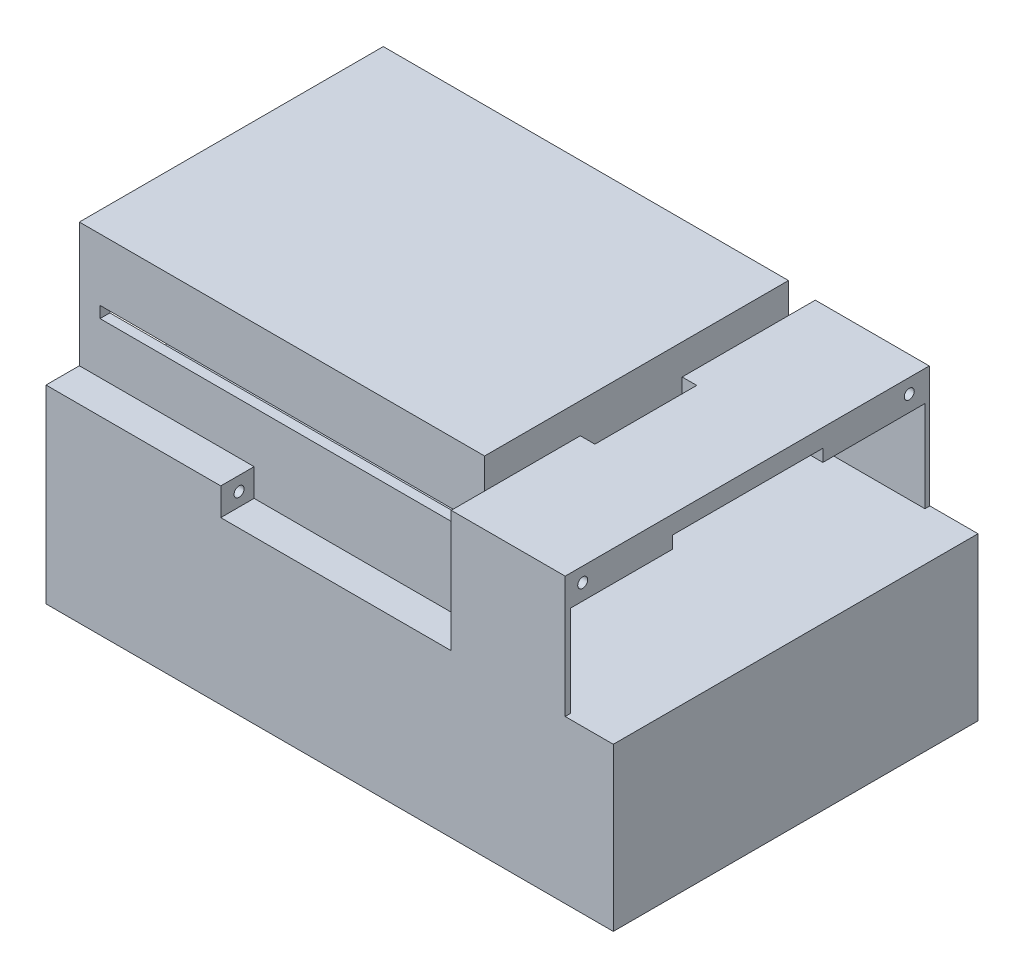
from build123d import *

# Parameters (mm, degrees)
SKETCH1_W           = 142.24
SKETCH1_H           = 91.44
BOSS_EXTRUDE1_DEPTH = 40.64
SKETCH3_W           = 101.6
SKETCH3_H           = 76.2
BOSS_EXTRUDE2_DEPTH = 38.1
SKETCH4_W           = 70.885711102
SKETCH4_H           = 34.639527003
CUT_EXTRUDE2_DEPTH  = 97.79
SKETCH5_W           = 90.875163882
SKETCH5_H           = 2.870686322
CUT_EXTRUDE3_DEPTH  = 97.79
SKETCH8_W           = 91.28479526
SKETCH8_H           = 30.48
BOSS_EXTRUDE4_DEPTH = 28.575
SKETCH9_W           = 37.704579212
SKETCH9_H           = 3.084273822
CUT_EXTRUDE4_DEPTH  = 28.321
SKETCH10_W          = 3.65161605
SKETCH10_H          = 25.540665071
CUT_EXTRUDE5_DEPTH  = 14.097
SKETCH2_W           = 87.63
SKETCH2_H           = 36.83
CUT_EXTRUDE6_DEPTH  = 225.933
SKETCH12_W          = 91.44
SKETCH12_H          = 40.64
BOSS_EXTRUDE5_DEPTH = 2.667
SKETCH13_W          = 6.720820965
SKETCH13_H          = 6.891818051
SKETCH13_R          = 1.25
SKETCH13_W_2        = 8.363974295
BOSS_EXTRUDE6_DEPTH = 43.815
SKETCH14_R          = 1.25
CUT_EXTRUDE7_DEPTH  = 13.843


with BuildPart() as part:
    # Sketch1 → Boss-Extrude1 (new body)
    with BuildSketch(Plane(origin=(0, 0, 0), x_dir=(1, 0, 0), z_dir=(0, 1, 0))):
        Rectangle(SKETCH1_W, SKETCH1_H)
    extrude(amount=BOSS_EXTRUDE1_DEPTH)

    # Sketch3 → Boss-Extrude2 (add)
    with BuildSketch(Plane(origin=(0, 40.64, 0), x_dir=(1, 0, 0), z_dir=(0, 1, 0))):
        with Locations((-20.32, 0.743974295)):
            Rectangle(SKETCH3_W, SKETCH3_H)
    extrude(amount=BOSS_EXTRUDE2_DEPTH)

    # Sketch4 → Cut-Extrude2 (cut)
    with BuildSketch(Plane.ZY.offset(71.12)):
        with Locations((-0.546263413, 58.617752018)):
            Rectangle(SKETCH4_W, SKETCH4_H)
    extrude(amount=-CUT_EXTRUDE2_DEPTH, mode=Mode.SUBTRACT)

    # Sketch5 → Cut-Extrude3 (cut)
    with BuildSketch(Plane.XY.offset(37.356025705)):
        with Locations((-20.498494518, 61.797236891)):
            Rectangle(SKETCH5_W, SKETCH5_H)
    extrude(amount=-CUT_EXTRUDE3_DEPTH, mode=Mode.SUBTRACT)

    # Sketch8 → Boss-Extrude4 (add)
    with BuildSketch(Plane(origin=(30.48, 0, 0), x_dir=(0, 0, -1), z_dir=(1, 0, 0))):
        with Locations((-0.07760237, 55.88)):
            Rectangle(SKETCH8_W, SKETCH8_H)
    extrude(amount=BOSS_EXTRUDE4_DEPTH)

    # Sketch9 → Cut-Extrude4 (cut)
    with BuildSketch(Plane(origin=(59.055, 0, 0), x_dir=(0, 0, -1), z_dir=(1, 0, 0))):
        with Locations((0.04199785, 65.042136911)):
            Rectangle(SKETCH9_W, SKETCH9_H)
        with Locations((0.04199785, 61.957863089)):
            Rectangle(SKETCH9_W, SKETCH9_H)
        Polygon((-18.810291756, 63.5), (-44.40800215, 63.5), (-44.40800215, 40.64), (44.49199785, 40.64), (44.49199785, 63.5), (18.894287456, 63.5), (18.894287456, 60.415726178), (-18.810291756, 60.415726178), align=None)
    extrude(amount=-CUT_EXTRUDE4_DEPTH, mode=Mode.SUBTRACT)

    # Sketch10 → Cut-Extrude5 (cut)
    with BuildSketch(Plane(origin=(0, 71.12, 0), x_dir=(1, 0, 0), z_dir=(0, 1, 0))):
        with Locations((32.305808025, -0.58046966)):
            Rectangle(SKETCH10_W, SKETCH10_H)
    extrude(amount=-CUT_EXTRUDE5_DEPTH, mode=Mode.SUBTRACT)

    # Sketch2 → Cut-Extrude6 (cut)
    with BuildSketch(Plane(origin=(71.12, 0, 0), x_dir=(0, 0, -1), z_dir=(1, 0, 0))):
        with Locations((0, 20.32)):
            Rectangle(SKETCH2_W, SKETCH2_H)
    extrude(amount=-CUT_EXTRUDE6_DEPTH, mode=Mode.SUBTRACT)

    # Sketch12 → Boss-Extrude5 (add)
    with BuildSketch(Plane(origin=(71.12, 0, 0), x_dir=(0, 0, -1), z_dir=(1, 0, 0))):
        with Locations((0, 20.32)):
            Rectangle(SKETCH12_W, SKETCH12_H)
    extrude(amount=-BOSS_EXTRUDE5_DEPTH)

    # Sketch13 → Boss-Extrude6 (add)
    # profile 1 of 2: a face of its own
    with BuildSketch(Plane.ZY.offset(71.12)):
        with Locations((-42.204384778, 44.085909026)):
            Rectangle(SKETCH13_W, SKETCH13_H)
        with Locations((-41.837350795, 43.997172438)):
            Circle(SKETCH13_R, mode=Mode.SUBTRACT)
    # profile 2 of 2: a face of its own
    with BuildSketch(Plane.ZY.offset(71.12)):
        with Locations((41.538012853, 44.085909026)):
            Rectangle(SKETCH13_W_2, SKETCH13_H)
        with Locations((41.130421673, 43.997172438)):
            Circle(SKETCH13_R, mode=Mode.SUBTRACT)
    extrude(amount=-BOSS_EXTRUDE6_DEPTH)

    # Sketch14 → Cut-Extrude7 (cut)
    with BuildSketch(Plane(origin=(59.055, 0, 0), x_dir=(0, 0, -1), z_dir=(1, 0, 0))):
        with Locations((-41.323220525, 67.518632332)):
            Circle(SKETCH14_R)
        with Locations((40.552025118, 67.518632332)):
            Circle(SKETCH14_R)
    extrude(amount=-CUT_EXTRUDE7_DEPTH, mode=Mode.SUBTRACT)


solid = part.part
